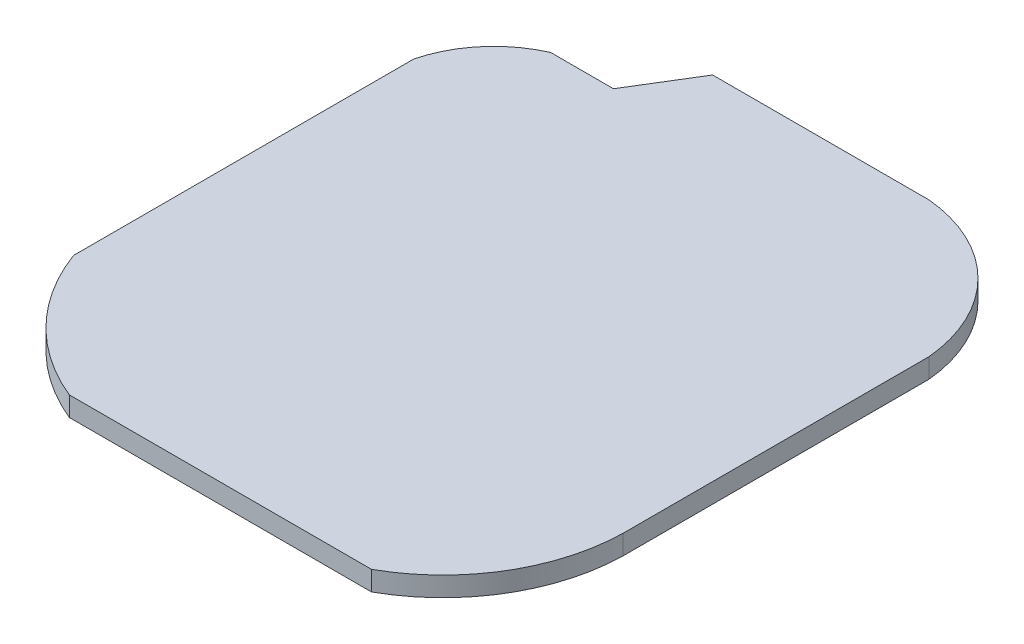
from build123d import *

# Parameters (mm, degrees)
SKETCH3_W               = 262.8
SKETCH3_H               = 305.28
BOSS_EXTRUDE3_DEPTH     = 10
CUT_EXTRUDE1_DEPTH      = 202.655472527
CUT_EXTRUDE1_DEPTH_BACK = 202.655472527


with BuildPart() as part:
    # Sketch3 → Boss-Extrude3 (new body)
    with BuildSketch(Plane(origin=(0, 0, 0), x_dir=(1, 0, 0), z_dir=(0, 1, 0))):
        Rectangle(SKETCH3_W, SKETCH3_H)
    extrude(amount=BOSS_EXTRUDE3_DEPTH)

    # Sketch4 → Cut-Extrude1 (cut, two sides: drawn at the far end of the back side and taken through both)
    with BuildSketch(Plane(origin=(0, 10, 0), x_dir=(1, 0, 0), z_dir=(0, 1, 0)).offset(-CUT_EXTRUDE1_DEPTH_BACK)):
        with BuildLine():
            Line((-131.4, -90), (-131.4, -152.64))
            Line((-131.4, -152.64), (-70.92, -152.64))
            ThreePointArc((-70.92, -152.64), (-107.755247271, -127.687824951), (-131.4, -90))
        make_face()
        with BuildLine():
            Line((83.16, -152.64), (131.4, -152.64))
            Line((131.4, -152.64), (131.4, -72.72))
            ThreePointArc((131.4, -72.72), (117.938305095, -119.113391364), (83.16, -152.64))
        make_face()
        with BuildLine():
            Line((-99.372734155, 121.287125755), (-67.345468311, 121.287125755))
            Line((-67.345468311, 121.287125755), (-48.15934209, 152.64))
            Line((-48.15934209, 152.64), (-131.4, 152.64))
            Line((-131.4, 152.64), (-131.4, 83.52))
            ThreePointArc((-131.4, 83.52), (-119.737831056, 106.093689962), (-99.372734155, 121.287125755))
        make_face()
        with BuildLine():
            Line((131.4, 83.52), (131.4, 152.64))
            Line((131.4, 152.64), (62.28, 152.64))
            ThreePointArc((62.28, 152.64), (109.286007047, 130.526007047), (131.4, 83.52))
        make_face()
    extrude(amount=CUT_EXTRUDE1_DEPTH + CUT_EXTRUDE1_DEPTH_BACK, mode=Mode.SUBTRACT)


solid = part.part
